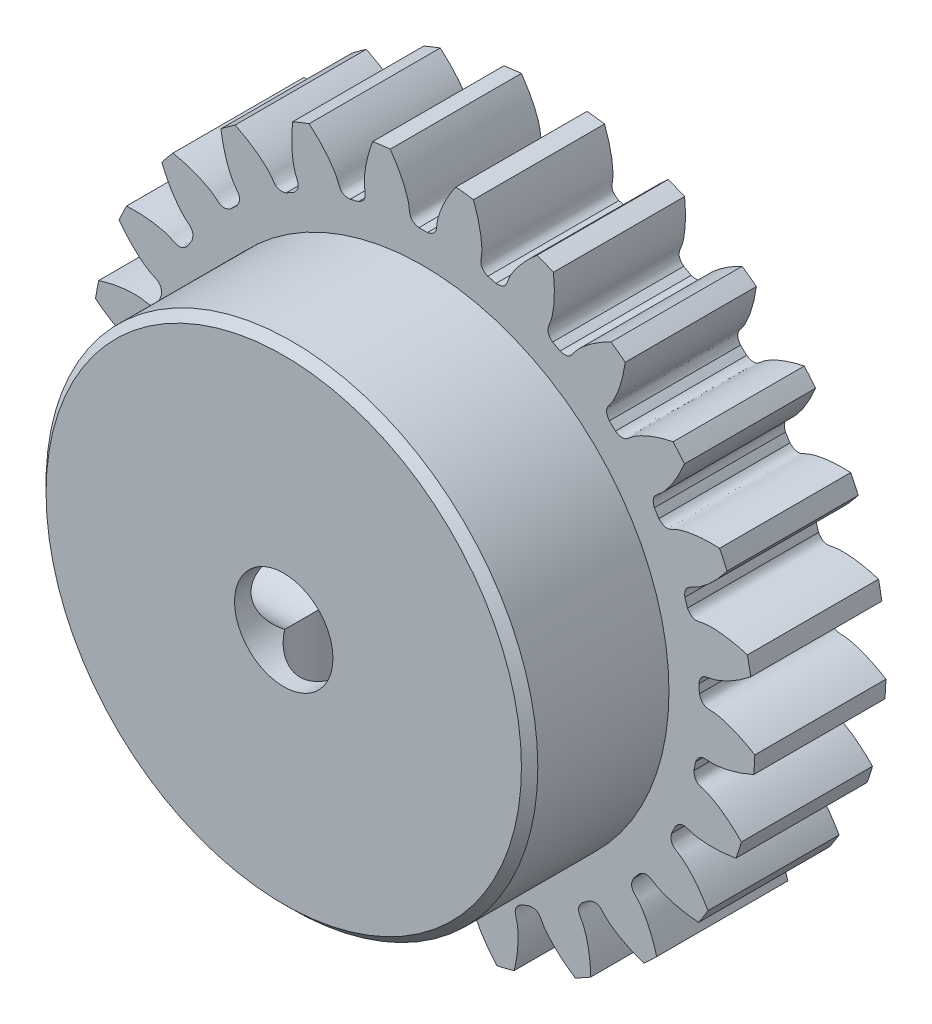
from build123d import *

# Parameters (mm, degrees)
SKETCH_1_R               = 20.25
EXTRUDE_1_DEPTH          = 8
CUT_EXTRUDE_1_DEPTH      = 30.734239523
PATTERN_CIRCULAR_1_COUNT = 25
SKETCH_4_R               = 15
EXTRUDE_2_DEPTH          = 8.5
CHAMFER_1_SIZE           = 0.5
SKETCH_5_R               = 3
CUT_EXTRUDE_3_DEPTH      = 30
SKETCH_6_R               = 2.5
CUT_EXTRUDE_4_DEPTH      = 30
SKETCH_7_R               = 2.5
CUT_EXTRUDE_5_DEPTH      = 30


with BuildPart() as part:
    # 草图1 → 凸台-拉伸1 (new body)
    with BuildSketch(Plane.XY):
        Circle(SKETCH_1_R)
    extrude(amount=EXTRUDE_1_DEPTH)

    # 草图2 → 切除-拉伸1 (cut, through all)
    with BuildSketch(Plane.XY):
        with BuildLine():
            ThreePointArc((0.258087731, 16.873026276), (0, 16.875), (-0.258087731, 16.873026276))
            add(Edge.make_bspline(
                [(-0.258087731, 16.873026276), (-0.860009719, 17.002621743), (-0.803261453, 17.365892092), (-0.861293078, 17.727079133), (-0.869431907, 17.772162663), (-0.879864646, 17.823983286), (-0.892853278, 17.882466675), (-0.908671177, 17.947527872), (-0.927584894, 18.019074596), (-0.949859769, 18.097006249), (-0.975757867, 18.181214325), (-1.005538339, 18.271582373), (-1.039457033, 18.367986118), (-1.077766339, 18.470293527), (-1.120714966, 18.578364907), (-1.168547739, 18.692053), (-1.221505397, 18.811203081), (-1.279824393, 18.935653067), (-1.343736695, 19.065233623), (-1.413469592, 19.199768283), (-1.489245502, 19.339073564), (-1.571281784, 19.482959099), (-1.659790547, 19.63122776), (-1.754978474, 19.783675797), (-1.857046639, 19.940092974), (-1.966190331, 20.100262717), (-2.082598879, 20.263962258), (-2.206455491, 20.430962791), (-2.337937079, 20.601029625), (-2.477214104, 20.773922351), (-2.624450417, 20.949394998), (-2.779803105, 21.127196214), (-2.943422343, 21.307069427), (-3.115451247, 21.488753029), (-3.296025735, 21.671980558), (-3.485274392, 21.856480874), (-3.683318332, 22.041978354), (-3.890271089, 22.228193081), (-4.106238429, 22.414841038), (-4.409960917, 22.666899411), (-4.646199824, 22.851139729), (-4.807907214, 22.972251257)],
                knots=[0, 0, 0, 0, 0.130741207, 0.13574479, 0.141658115, 0.148481183, 0.156213993, 0.164856545, 0.174408839, 0.184870876, 0.196242655, 0.208524177, 0.221715441, 0.235816447, 0.250827195, 0.266747686, 0.283577919, 0.301317894, 0.319967612, 0.339527072, 0.359996274, 0.381375219, 0.403663906, 0.426862335, 0.450970507, 0.475988421, 0.501916077, 0.528753476, 0.556500617, 0.5851575, 0.614724126, 0.645200493, 0.676586604, 0.708882456, 0.742088051, 0.776203388, 0.811228468, 0.847163289, 0.884007854, 0.92176216, 1, 1, 1, 1], degree=3))
            ThreePointArc((-4.807907214, 22.972251257), (0, 23.469987209), (4.807907214, 22.972251257))
            add(Edge.make_bspline(
                [(0.258087731, 16.873026276), (0.860009719, 17.002621743), (0.803261453, 17.365892092), (0.861293078, 17.727079133), (0.869431907, 17.772162663), (0.879864646, 17.823983286), (0.892853278, 17.882466675), (0.908671177, 17.947527872), (0.927584894, 18.019074596), (0.949859769, 18.097006249), (0.975757867, 18.181214325), (1.005538339, 18.271582373), (1.039457033, 18.367986118), (1.077766339, 18.470293527), (1.120714966, 18.578364907), (1.168547739, 18.692053), (1.221505397, 18.811203081), (1.279824393, 18.935653067), (1.343736695, 19.065233623), (1.413469592, 19.199768283), (1.489245502, 19.339073564), (1.571281784, 19.482959099), (1.659790547, 19.63122776), (1.754978474, 19.783675797), (1.857046639, 19.940092974), (1.966190331, 20.100262717), (2.082598879, 20.263962258), (2.206455491, 20.430962791), (2.337937079, 20.601029625), (2.477214104, 20.773922351), (2.624450417, 20.949394998), (2.779803105, 21.127196214), (2.943422343, 21.307069427), (3.115451247, 21.488753029), (3.296025735, 21.671980558), (3.485274392, 21.856480874), (3.683318332, 22.041978354), (3.890271089, 22.228193081), (4.106238429, 22.414841038), (4.409960917, 22.666899411), (4.646199824, 22.851139729), (4.807907214, 22.972251257)],
                knots=[0, 0, 0, 0, 0.130741207, 0.13574479, 0.141658115, 0.148481183, 0.156213993, 0.164856545, 0.174408839, 0.184870876, 0.196242655, 0.208524177, 0.221715441, 0.235816447, 0.250827195, 0.266747686, 0.283577919, 0.301317894, 0.319967612, 0.339527072, 0.359996274, 0.381375219, 0.403663906, 0.426862335, 0.450970507, 0.475988421, 0.501916077, 0.528753476, 0.556500617, 0.5851575, 0.614724126, 0.645200493, 0.676586604, 0.708882456, 0.742088051, 0.776203388, 0.811228468, 0.847163289, 0.884007854, 0.92176216, 1, 1, 1, 1], degree=3))
        make_face()
    cut_extrude_1 = extrude(amount=CUT_EXTRUDE_1_DEPTH, mode=Mode.SUBTRACT)

    # 阵列(圆周)1: 切除-拉伸1 ×25 about axis
    pattern_circular_1_axis = Axis((0, 0, -0.75), (0, 0, 1))
    for i in range(1, PATTERN_CIRCULAR_1_COUNT):
        add(cut_extrude_1.rotate(pattern_circular_1_axis, i * 360 / PATTERN_CIRCULAR_1_COUNT), mode=Mode.SUBTRACT)

    # 草图4 → 凸台-拉伸2 (add)
    with BuildSketch(Plane.XY.offset(8)):
        Circle(SKETCH_4_R)
    extrude(amount=EXTRUDE_2_DEPTH)

    # 倒角1
    chamfer_1_edges = [part.edges().sort_by_distance(p)[0] for p in [
        (-15, 0, 16.5),
    ]]
    chamfer(chamfer_1_edges, length=CHAMFER_1_SIZE)

    # 草图5 → 切除-拉伸3 (cut)
    with BuildSketch(Plane.XY.offset(16.5)):
        Circle(SKETCH_5_R)
    extrude(amount=-CUT_EXTRUDE_3_DEPTH, mode=Mode.SUBTRACT)

    # 草图6 → 切除-拉伸4 (cut)
    with BuildSketch(Plane(origin=(0, 0, 0), x_dir=(1, 0, 0), z_dir=(0, 1, 0))):
        with Locations((0, -13)):
            Circle(SKETCH_6_R)
    extrude(amount=-CUT_EXTRUDE_4_DEPTH, mode=Mode.SUBTRACT)

    # 草图7 → 切除-拉伸5 (cut)
    with BuildSketch(Plane(origin=(0, 0, 0), x_dir=(0, 0, -1), z_dir=(1, 0, 0))):
        with Locations((-13, 0)):
            Circle(SKETCH_7_R)
    extrude(amount=-CUT_EXTRUDE_5_DEPTH, mode=Mode.SUBTRACT)


solid = part.part
